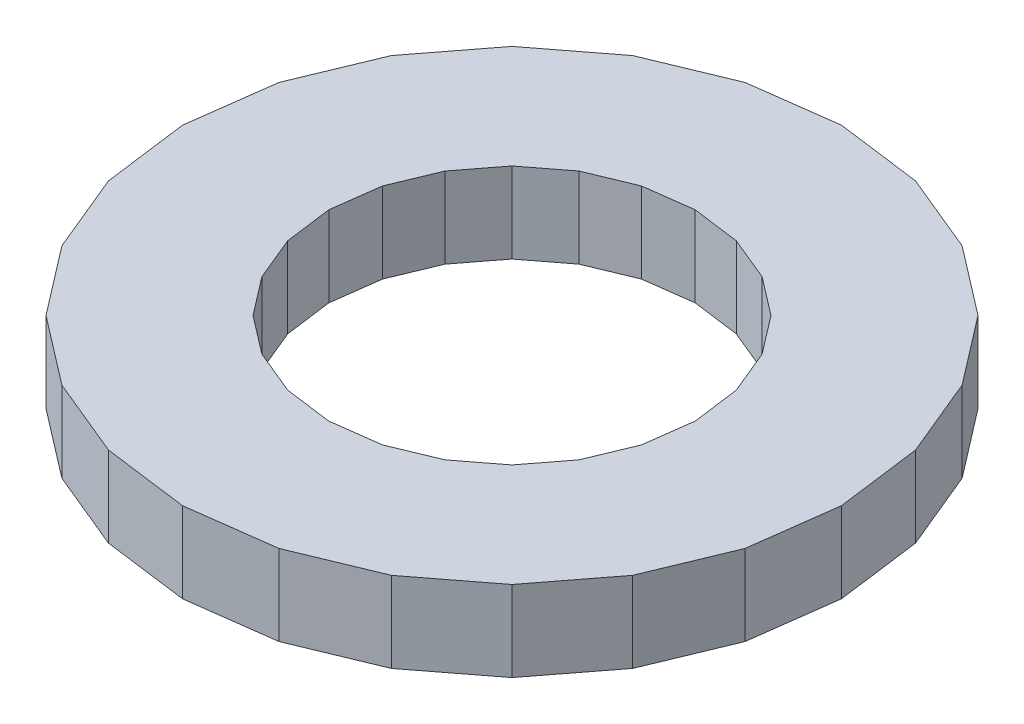
from build123d import *

# Parameters (mm, degrees)
BOSS_EXTRUDE3_DEPTH = 19.05


with BuildPart() as part:
    # Sketch3 → Boss-Extrude3 (new body)
    with BuildSketch(Plane(origin=(0, 0, 0), x_dir=(1, 0, 0), z_dir=(0, 1, 0))):
        Polygon((-77.838783367, 0), (-75.186491142, -20.146159583), (-67.410363796, -38.919391684), (-55.040331558, -55.040331558), (-38.919391684, -67.410363796), (-20.146159583, -75.186491142), (0, -77.838783367), (20.146159583, -75.186491142), (38.919391684, -67.410363796), (55.040331558, -55.040331558), (67.410363796, -38.919391684), (75.186491142, -20.146159583), (77.838783367, 0), (75.186491142, 20.146159583), (67.410363796, 38.919391684), (55.040331558, 55.040331558), (38.919391684, 67.410363796), (20.146159583, 75.186491142), (0, 77.838783367), (-20.146159583, 75.186491142), (-38.919391684, 67.410363796), (-55.040331558, 55.040331558), (-67.410363796, 38.919391684), (-75.186491142, 20.146159583), align=None)
        Polygon((-43.252896309, 0), (-41.779089607, -11.194673321), (-37.458106991, -21.626448155), (-30.584416286, -30.584416286), (-21.626448155, -37.458106991), (-11.194673321, -41.779089607), (0, -43.252896309), (11.194673321, -41.779089607), (21.626448155, -37.458106991), (30.584416286, -30.584416286), (37.458106991, -21.626448155), (41.779089607, -11.194673321), (43.252896309, 0), (41.779089607, 11.194673321), (37.458106991, 21.626448155), (30.584416286, 30.584416286), (21.626448155, 37.458106991), (11.194673321, 41.779089607), (0, 43.252896309), (-11.194673321, 41.779089607), (-21.626448155, 37.458106991), (-30.584416286, 30.584416286), (-37.458106991, 21.626448155), (-41.779089607, 11.194673321), align=None, mode=Mode.SUBTRACT)
    extrude(amount=BOSS_EXTRUDE3_DEPTH)


solid = part.part
